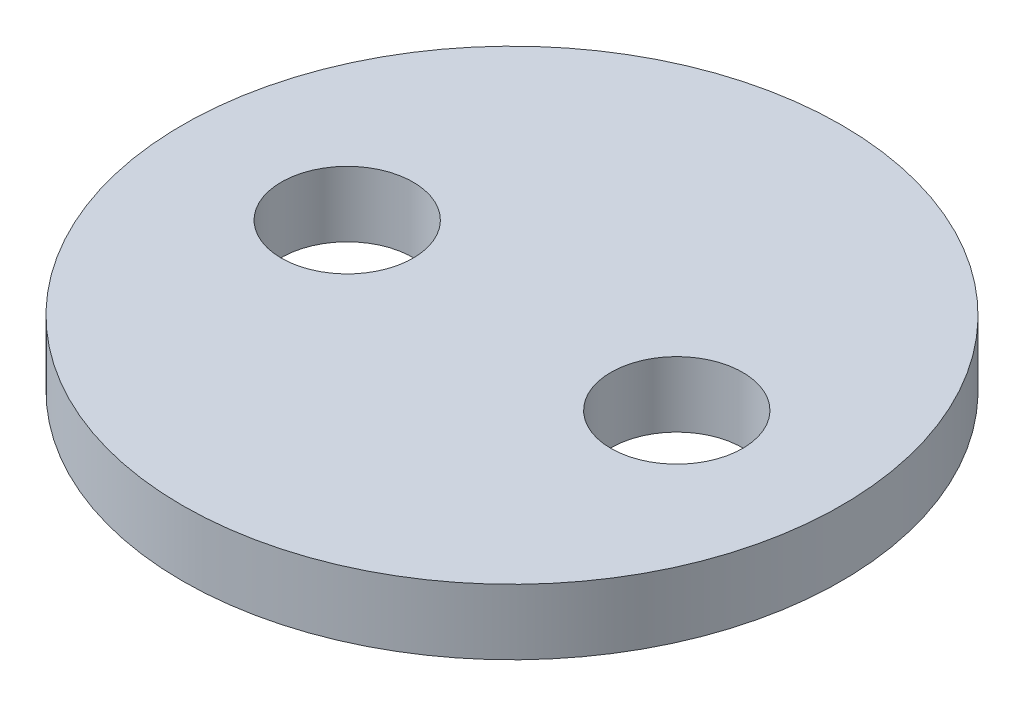
from build123d import *

# Parameters (mm, degrees)
SKETCH1_R           = 16
SKETCH1_R_2         = 3.2
BOSS_EXTRUDE3_DEPTH = 3.175


with BuildPart() as part:
    # Sketch1 → Boss-Extrude3 (new body)
    with BuildSketch(Plane(origin=(0, 0, 0), x_dir=(1, 0, 0), z_dir=(0, 1, 0))):
        with Locations(Location((0, 0, 0), (0, 0, 270))):
            Circle(SKETCH1_R)
        with Locations(Location((8, 0, 0), (0, 0, 270))):
            Circle(SKETCH1_R_2, mode=Mode.SUBTRACT)
        with Locations(Location((-8, 0, 0), (0, 0, 270))):
            Circle(SKETCH1_R_2, mode=Mode.SUBTRACT)
    extrude(amount=BOSS_EXTRUDE3_DEPTH)


solid = part.part
